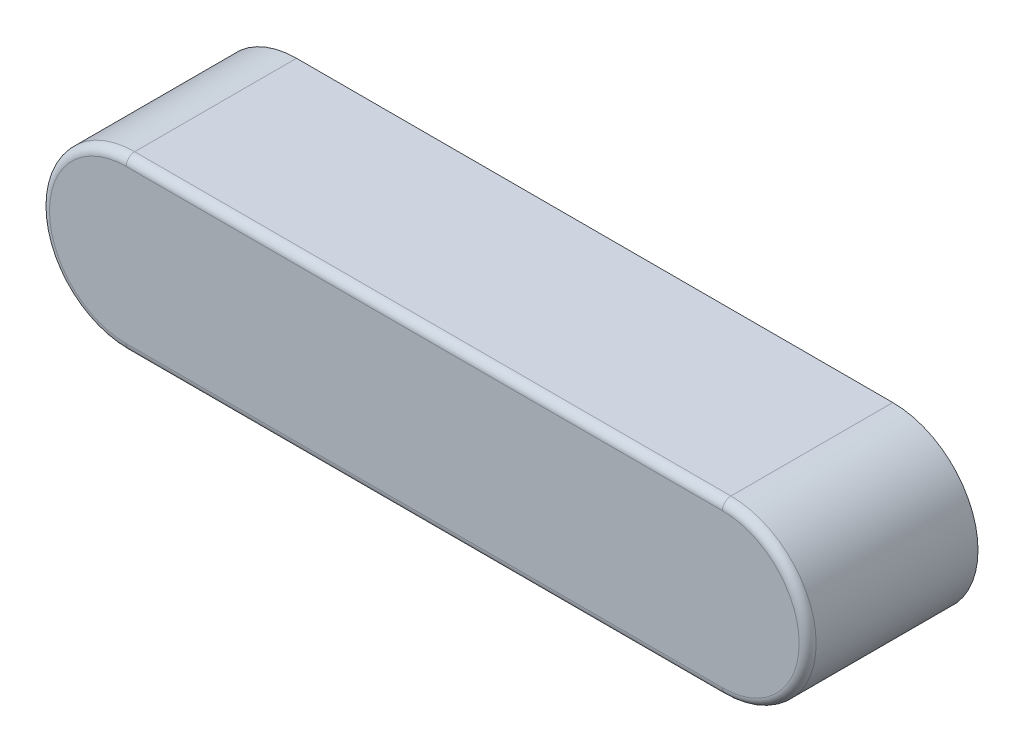
from build123d import *

# Parameters (mm, degrees)
EXTRUDE_1_DEPTH = 2
FILLET_1_R      = 0.1


with BuildPart() as part:
    # 草图1 → 凸台-拉伸1 (new body)
    with BuildSketch(Plane.XY):
        with BuildLine():
            Line((-4.817578773, 2.290590087), (2.182421227, 2.290590087))
            ThreePointArc((2.182421227, 2.290590087), (3.182421227, 1.290590087), (2.182421227, 0.290590087))
            Line((2.182421227, 0.290590087), (-4.817578773, 0.290590087))
            ThreePointArc((-4.817578773, 0.290590087), (-5.817578773, 1.290590087), (-4.817578773, 2.290590087))
        make_face()
    extrude(amount=EXTRUDE_1_DEPTH)

    # 圆角1
    fillet_1_edges = [part.edges().sort_by_distance(p)[0] for p in [
        (3.182421227, 1.290590087, 2),
        (-1.317578773, 2.290590087, 2),
        (-5.817578773, 1.290590087, 2),
        (-1.317578773, 0.290590087, 2),
    ]]
    fillet(fillet_1_edges, radius=FILLET_1_R)


solid = part.part
